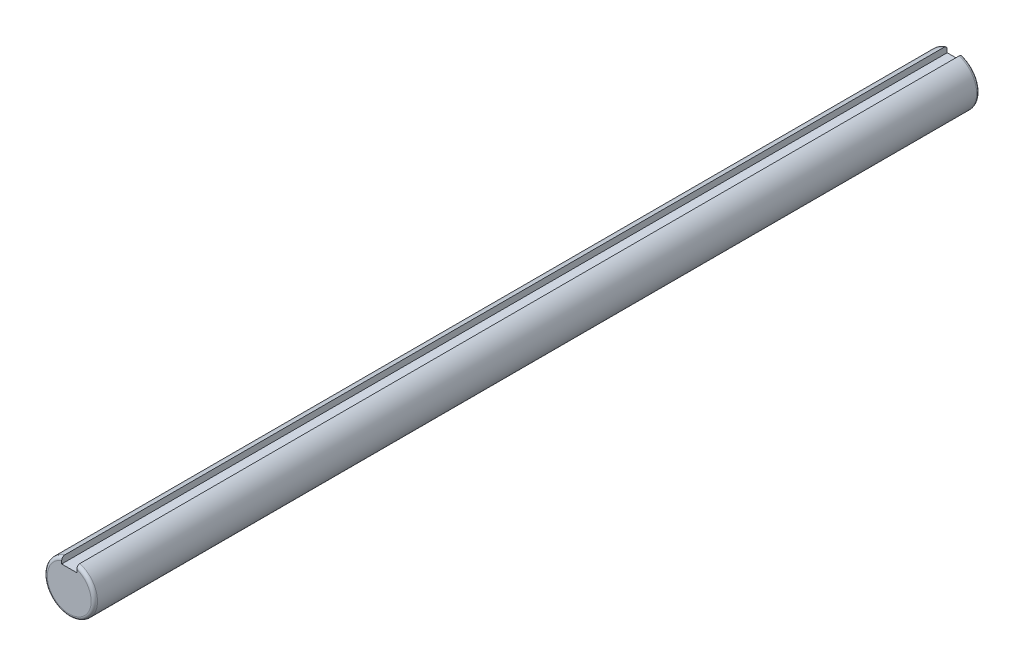
from build123d import *

# Parameters (mm, degrees)
SKETCH1_R           = 3.96875
BOSS_EXTRUDE1_DEPTH = 140
SKETCH3_W           = 2.38125
SKETCH3_H           = 1.190625
CUT_EXTRUDE2_DEPTH  = 141.112461805
FILLET1_R           = 0.5


with BuildPart() as part:
    # Sketch1 → Boss-Extrude1 (new body)
    with BuildSketch(Plane.XY):
        Circle(SKETCH1_R)
    extrude(amount=BOSS_EXTRUDE1_DEPTH)

    # Sketch3 → Cut-Extrude2 (cut, through all)
    with BuildSketch(Plane(origin=(0, 0, 0), x_dir=(-1, 0, 0), z_dir=(0, 0, -1))):
        with Locations((0, 3.3734375)):
            Rectangle(SKETCH3_W, SKETCH3_H)
    extrude(amount=-CUT_EXTRUDE2_DEPTH, mode=Mode.SUBTRACT)

    # Fillet1
    fillet1_edges = [part.edges().sort_by_distance(p)[0] for p in [
        (0, -3.96875, 0),
        (0, -3.96875, 140),
    ]]
    fillet(fillet1_edges, radius=FILLET1_R)


solid = part.part
